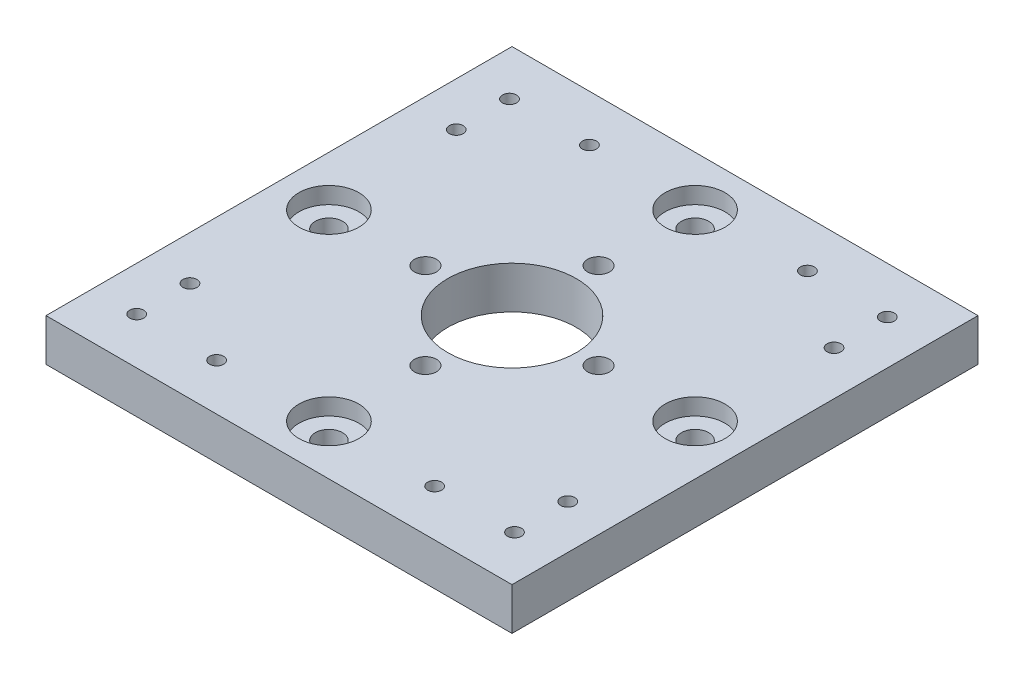
from build123d import *

# Parameters (mm, degrees)
SKETCH1_W           = 70
SKETCH1_H           = 70
SKETCH1_R           = 1.65
BOSS_EXTRUDE1_DEPTH = 6.35
CUT_EXTRUDE1_REACH  = 51.903
SKETCH2_R           = 1.05
CUT_EXTRUDE2_REACH  = 51.903
SKETCH3_R           = 9.65
CUT_EXTRUDE3_REACH  = 51.903
SKETCH4_R           = 2.05
SKETCH5_R           = 4.5
CUT_EXTRUDE4_DEPTH  = 2.5


with BuildPart() as part:
    # Sketch1 → Boss-Extrude1 (new body)
    with BuildSketch(Plane(origin=(0, 0, 0), x_dir=(1, 0, 0), z_dir=(0, 1, 0))):
        Rectangle(SKETCH1_W, SKETCH1_H)
        with Locations(Location((0, 13, 0), (0, 0, 270))):
            Circle(SKETCH1_R, mode=Mode.SUBTRACT)
        with Locations(Location((13, 0, 0), (0, 0, 270))):
            Circle(SKETCH1_R, mode=Mode.SUBTRACT)
        with Locations(Location((0, -13, 0), (0, 0, 270))):
            Circle(SKETCH1_R, mode=Mode.SUBTRACT)
        with Locations(Location((-13, 0, 0), (0, 0, 270))):
            Circle(SKETCH1_R, mode=Mode.SUBTRACT)
    extrude(amount=BOSS_EXTRUDE1_DEPTH)

    # Sketch2 → Cut-Extrude1 (cut, up to next)
    with BuildSketch(Plane(origin=(0, 6.35, 0), x_dir=(1, 0, 0), z_dir=(0, 1, 0)), mode=Mode.PRIVATE) as cut_extrude1_sk1:
        with Locations(Location((16.375, 28, 0), (0, 0, 270))):
            Circle(SKETCH2_R)
    cut_extrude1_tool1 = extrude(cut_extrude1_sk1.sketch, amount=-CUT_EXTRUDE1_REACH, mode=Mode.PRIVATE) & part.part
    # Sketch2 → Cut-Extrude1 (cut, up to next)
    with BuildSketch(Plane(origin=(0, 6.35, 0), x_dir=(1, 0, 0), z_dir=(0, 1, 0)), mode=Mode.PRIVATE) as cut_extrude1_sk2:
        with Locations(Location((28.375, 28, 0), (0, 0, 270))):
            Circle(SKETCH2_R)
    cut_extrude1_tool2 = extrude(cut_extrude1_sk2.sketch, amount=-CUT_EXTRUDE1_REACH, mode=Mode.PRIVATE) & part.part
    # Sketch2 → Cut-Extrude1 (cut, up to next)
    with BuildSketch(Plane(origin=(0, 6.35, 0), x_dir=(1, 0, 0), z_dir=(0, 1, 0)), mode=Mode.PRIVATE) as cut_extrude1_sk3:
        with Locations(Location((28.375, 20, 0), (0, 0, 270))):
            Circle(SKETCH2_R)
    cut_extrude1_tool3 = extrude(cut_extrude1_sk3.sketch, amount=-CUT_EXTRUDE1_REACH, mode=Mode.PRIVATE) & part.part
    # Sketch2 → Cut-Extrude1 (cut, up to next)
    with BuildSketch(Plane(origin=(0, 6.35, 0), x_dir=(1, 0, 0), z_dir=(0, 1, 0)), mode=Mode.PRIVATE) as cut_extrude1_sk4:
        with Locations(Location((-28.375, 20, 0), (0, 0, 270))):
            Circle(SKETCH2_R)
    cut_extrude1_tool4 = extrude(cut_extrude1_sk4.sketch, amount=-CUT_EXTRUDE1_REACH, mode=Mode.PRIVATE) & part.part
    # Sketch2 → Cut-Extrude1 (cut, up to next)
    with BuildSketch(Plane(origin=(0, 6.35, 0), x_dir=(1, 0, 0), z_dir=(0, 1, 0)), mode=Mode.PRIVATE) as cut_extrude1_sk5:
        with Locations(Location((-28.375, 28, 0), (0, 0, 270))):
            Circle(SKETCH2_R)
    cut_extrude1_tool5 = extrude(cut_extrude1_sk5.sketch, amount=-CUT_EXTRUDE1_REACH, mode=Mode.PRIVATE) & part.part
    # Sketch2 → Cut-Extrude1 (cut, up to next)
    with BuildSketch(Plane(origin=(0, 6.35, 0), x_dir=(1, 0, 0), z_dir=(0, 1, 0)), mode=Mode.PRIVATE) as cut_extrude1_sk6:
        with Locations(Location((-16.375, 28, 0), (0, 0, 270))):
            Circle(SKETCH2_R)
    cut_extrude1_tool6 = extrude(cut_extrude1_sk6.sketch, amount=-CUT_EXTRUDE1_REACH, mode=Mode.PRIVATE) & part.part
    # Sketch2 → Cut-Extrude1 (cut, up to next)
    with BuildSketch(Plane(origin=(0, 6.35, 0), x_dir=(1, 0, 0), z_dir=(0, 1, 0)), mode=Mode.PRIVATE) as cut_extrude1_sk7:
        with Locations(Location((28.375, -20, 0), (0, 0, 270))):
            Circle(SKETCH2_R)
    cut_extrude1_tool7 = extrude(cut_extrude1_sk7.sketch, amount=-CUT_EXTRUDE1_REACH, mode=Mode.PRIVATE) & part.part
    # Sketch2 → Cut-Extrude1 (cut, up to next)
    with BuildSketch(Plane(origin=(0, 6.35, 0), x_dir=(1, 0, 0), z_dir=(0, 1, 0)), mode=Mode.PRIVATE) as cut_extrude1_sk8:
        with Locations(Location((28.375, -28, 0), (0, 0, 270))):
            Circle(SKETCH2_R)
    cut_extrude1_tool8 = extrude(cut_extrude1_sk8.sketch, amount=-CUT_EXTRUDE1_REACH, mode=Mode.PRIVATE) & part.part
    # Sketch2 → Cut-Extrude1 (cut, up to next)
    with BuildSketch(Plane(origin=(0, 6.35, 0), x_dir=(1, 0, 0), z_dir=(0, 1, 0)), mode=Mode.PRIVATE) as cut_extrude1_sk9:
        with Locations(Location((16.375, -28, 0), (0, 0, 270))):
            Circle(SKETCH2_R)
    cut_extrude1_tool9 = extrude(cut_extrude1_sk9.sketch, amount=-CUT_EXTRUDE1_REACH, mode=Mode.PRIVATE) & part.part
    # Sketch2 → Cut-Extrude1 (cut, up to next)
    with BuildSketch(Plane(origin=(0, 6.35, 0), x_dir=(1, 0, 0), z_dir=(0, 1, 0)), mode=Mode.PRIVATE) as cut_extrude1_sk10:
        with Locations(Location((-16.375, -28, 0), (0, 0, 270))):
            Circle(SKETCH2_R)
    cut_extrude1_tool10 = extrude(cut_extrude1_sk10.sketch, amount=-CUT_EXTRUDE1_REACH, mode=Mode.PRIVATE) & part.part
    # Sketch2 → Cut-Extrude1 (cut, up to next)
    with BuildSketch(Plane(origin=(0, 6.35, 0), x_dir=(1, 0, 0), z_dir=(0, 1, 0)), mode=Mode.PRIVATE) as cut_extrude1_sk11:
        with Locations(Location((-28.375, -20, 0), (0, 0, 270))):
            Circle(SKETCH2_R)
    cut_extrude1_tool11 = extrude(cut_extrude1_sk11.sketch, amount=-CUT_EXTRUDE1_REACH, mode=Mode.PRIVATE) & part.part
    # Sketch2 → Cut-Extrude1 (cut, up to next)
    with BuildSketch(Plane(origin=(0, 6.35, 0), x_dir=(1, 0, 0), z_dir=(0, 1, 0)), mode=Mode.PRIVATE) as cut_extrude1_sk12:
        with Locations(Location((-28.375, -28, 0), (0, 0, 270))):
            Circle(SKETCH2_R)
    cut_extrude1_tool12 = extrude(cut_extrude1_sk12.sketch, amount=-CUT_EXTRUDE1_REACH, mode=Mode.PRIVATE) & part.part
    add(cut_extrude1_tool1.solids().sort_by_distance((16.375, 6.35, -28))[0], mode=Mode.SUBTRACT)
    add(cut_extrude1_tool2.solids().sort_by_distance((28.375, 6.35, -28))[0], mode=Mode.SUBTRACT)
    add(cut_extrude1_tool3.solids().sort_by_distance((28.375, 6.35, -20))[0], mode=Mode.SUBTRACT)
    add(cut_extrude1_tool4.solids().sort_by_distance((-28.375, 6.35, -20))[0], mode=Mode.SUBTRACT)
    add(cut_extrude1_tool5.solids().sort_by_distance((-28.375, 6.35, -28))[0], mode=Mode.SUBTRACT)
    add(cut_extrude1_tool6.solids().sort_by_distance((-16.375, 6.35, -28))[0], mode=Mode.SUBTRACT)
    add(cut_extrude1_tool7.solids().sort_by_distance((28.375, 6.35, 20))[0], mode=Mode.SUBTRACT)
    add(cut_extrude1_tool8.solids().sort_by_distance((28.375, 6.35, 28))[0], mode=Mode.SUBTRACT)
    add(cut_extrude1_tool9.solids().sort_by_distance((16.375, 6.35, 28))[0], mode=Mode.SUBTRACT)
    add(cut_extrude1_tool10.solids().sort_by_distance((-16.375, 6.35, 28))[0], mode=Mode.SUBTRACT)
    add(cut_extrude1_tool11.solids().sort_by_distance((-28.375, 6.35, 20))[0], mode=Mode.SUBTRACT)
    add(cut_extrude1_tool12.solids().sort_by_distance((-28.375, 6.35, 28))[0], mode=Mode.SUBTRACT)

    # Sketch3 → Cut-Extrude2 (cut, up to next)
    with BuildSketch(Plane(origin=(0, 6.35, 0), x_dir=(1, 0, 0), z_dir=(0, 1, 0)), mode=Mode.PRIVATE) as cut_extrude2_sk1:
        with Locations(Location((0, 0, 0), (0, 0, 270))):
            Circle(SKETCH3_R)
    cut_extrude2_tool1 = extrude(cut_extrude2_sk1.sketch, amount=-CUT_EXTRUDE2_REACH, mode=Mode.PRIVATE) & part.part
    add(cut_extrude2_tool1.solids().sort_by_distance((0, 6.35, 0))[0], mode=Mode.SUBTRACT)

    # Sketch4 → Cut-Extrude3 (cut, up to next)
    with BuildSketch(Plane(origin=(0, 6.35, 0), x_dir=(1, 0, 0), z_dir=(0, 1, 0)), mode=Mode.PRIVATE) as cut_extrude3_sk1:
        with Locations(Location((0, 27.5, 0), (0, 0, 270))):
            Circle(SKETCH4_R)
    cut_extrude3_tool1 = extrude(cut_extrude3_sk1.sketch, amount=-CUT_EXTRUDE3_REACH, mode=Mode.PRIVATE) & part.part
    # Sketch4 → Cut-Extrude3 (cut, up to next)
    with BuildSketch(Plane(origin=(0, 6.35, 0), x_dir=(1, 0, 0), z_dir=(0, 1, 0)), mode=Mode.PRIVATE) as cut_extrude3_sk2:
        with Locations(Location((27.5, 0, 0), (0, 0, 270))):
            Circle(SKETCH4_R)
    cut_extrude3_tool2 = extrude(cut_extrude3_sk2.sketch, amount=-CUT_EXTRUDE3_REACH, mode=Mode.PRIVATE) & part.part
    # Sketch4 → Cut-Extrude3 (cut, up to next)
    with BuildSketch(Plane(origin=(0, 6.35, 0), x_dir=(1, 0, 0), z_dir=(0, 1, 0)), mode=Mode.PRIVATE) as cut_extrude3_sk3:
        with Locations(Location((0, -27.5, 0), (0, 0, 270))):
            Circle(SKETCH4_R)
    cut_extrude3_tool3 = extrude(cut_extrude3_sk3.sketch, amount=-CUT_EXTRUDE3_REACH, mode=Mode.PRIVATE) & part.part
    # Sketch4 → Cut-Extrude3 (cut, up to next)
    with BuildSketch(Plane(origin=(0, 6.35, 0), x_dir=(1, 0, 0), z_dir=(0, 1, 0)), mode=Mode.PRIVATE) as cut_extrude3_sk4:
        with Locations(Location((-27.5, 0, 0), (0, 0, 270))):
            Circle(SKETCH4_R)
    cut_extrude3_tool4 = extrude(cut_extrude3_sk4.sketch, amount=-CUT_EXTRUDE3_REACH, mode=Mode.PRIVATE) & part.part
    add(cut_extrude3_tool1.solids().sort_by_distance((0, 6.35, -27.5))[0], mode=Mode.SUBTRACT)
    add(cut_extrude3_tool2.solids().sort_by_distance((27.5, 6.35, 0))[0], mode=Mode.SUBTRACT)
    add(cut_extrude3_tool3.solids().sort_by_distance((0, 6.35, 27.5))[0], mode=Mode.SUBTRACT)
    add(cut_extrude3_tool4.solids().sort_by_distance((-27.5, 6.35, 0))[0], mode=Mode.SUBTRACT)

    # Sketch5 → Cut-Extrude4 (cut)
    with BuildSketch(Plane(origin=(0, 6.35, 0), x_dir=(1, 0, 0), z_dir=(0, 1, 0))):
        with Locations(Location((0, 27.5, 0), (0, 0, 270))):
            Circle(SKETCH5_R)
        with Locations(Location((27.5, 0, 0), (0, 0, 270))):
            Circle(SKETCH5_R)
        with Locations(Location((0, -27.5, 0), (0, 0, 270))):
            Circle(SKETCH5_R)
        with Locations(Location((-27.5, 0, 0), (0, 0, 270))):
            Circle(SKETCH5_R)
    extrude(amount=-CUT_EXTRUDE4_DEPTH, mode=Mode.SUBTRACT)


solid = part.part
